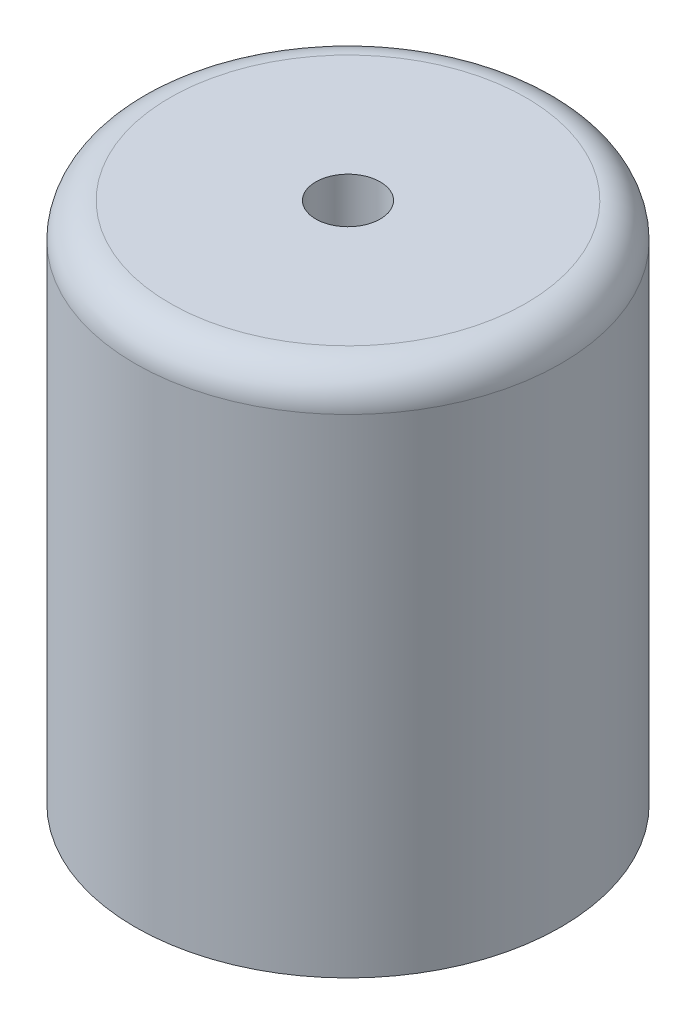
from build123d import *

# Parameters (mm, degrees)
BOSS_EXTRUDE1_DEPTH      = 8.509
BOSS_EXTRUDE1_DEPTH_BACK = 8.509
SKETCH3_R                = 15.519490552
BOSS_EXTRUDE2_DEPTH      = 38.1
SKETCH4_R                = 10.825000036
CUT_EXTRUDE1_DEPTH       = 31.75
CUT_EXTRUDE2_DEPTH       = 73.611468784
CUT_EXTRUDE2_DEPTH_BACK  = 73.611468784
SKETCH5_W                = 9.906
SKETCH5_H                = 56.435801088
SKETCH6_R                = 5.08
CUT_EXTRUDE3_DEPTH       = 75.892851262
CHAMFER1_SIZE            = 0.254
CHAMFER2_SIZE            = 0.508
FILLET1_R                = 1.27
FILLET2_R                = 1.27
SKETCH11_R               = 15.519490552
CUT_EXTRUDE4_DEPTH       = 45.520887291
FILLET4_R                = 2.54
SKETCH12_R               = 2.3495
CUT_EXTRUDE5_DEPTH       = 44.969525515
CUT_EXTRUDE6_START       = 31.75
SKETCH13_R               = 10.875012636
CUT_EXTRUDE6_DEPTH       = 23.876
CUT_EXTRUDE7_START       = 23.876
SKETCH14_R               = 10.925012636
CUT_EXTRUDE7_DEPTH       = 16.002


with BuildPart() as part:
    # Sketch2 → Boss-Extrude1 (new, two sides: drawn at the far end of the back side and taken through both)
    with BuildSketch(Plane.XY.offset(-BOSS_EXTRUDE1_DEPTH_BACK)):
        with BuildLine():
            Line((11.43, -31.115), (7.565118148, 0.912900544))
            ThreePointArc((7.565118148, 0.912900544), (0, 7.62), (-7.565118148, 0.912900544))
            Line((-7.565118148, 0.912900544), (-11.43, -31.115))
            Line((-11.43, -31.115), (11.43, -31.115))
        make_face()
    extrude(amount=BOSS_EXTRUDE1_DEPTH + BOSS_EXTRUDE1_DEPTH_BACK)

    # Sketch3 → Boss-Extrude2 (add)
    with BuildSketch(Plane.XZ.offset(31.115)):
        with Locations(Location((0, 0, 0), (0, 0, 180))):
            Circle(SKETCH3_R)
    extrude(amount=BOSS_EXTRUDE2_DEPTH)

    # Sketch4 → Cut-Extrude1 (cut)
    with BuildSketch(Plane.XZ.offset(69.215)):
        Circle(SKETCH4_R)
    extrude(amount=-CUT_EXTRUDE1_DEPTH, mode=Mode.SUBTRACT)

    # Sketch5 → Cut-Extrude2 (cut, two sides: drawn at the far end of the back side and taken through both)
    with BuildSketch(Plane(origin=(0, 0, 0), x_dir=(0, 0, -1), z_dir=(1, 0, 0)).offset(-CUT_EXTRUDE2_DEPTH_BACK)):
        with Locations((0, 0.912900544)):
            Rectangle(SKETCH5_W, SKETCH5_H)
    extrude(amount=CUT_EXTRUDE2_DEPTH + CUT_EXTRUDE2_DEPTH_BACK, mode=Mode.SUBTRACT)

    # Sketch6 → Cut-Extrude3 (cut, through all)
    with BuildSketch(Plane(origin=(0, 0, -8.509), x_dir=(-1, 0, 0), z_dir=(0, 0, -1))):
        with Locations(Location((0, 0, 0), (0, 0, 180))):
            Circle(SKETCH6_R)
    extrude(amount=-CUT_EXTRUDE3_DEPTH, mode=Mode.SUBTRACT)

    # Chamfer1
    chamfer1_edges = [part.edges().sort_by_distance(p)[0] for p in [
        (-5.08, 0, 8.509),
        (-5.08, 0, -4.953),
        (-5.08, 0, 4.953),
        (-5.08, 0, -8.509),
    ]]
    chamfer(chamfer1_edges, length=CHAMFER1_SIZE)

    # Chamfer2
    chamfer2_edges = [part.edges().sort_by_distance(p)[0] for p in [
        (-10.825000036, -69.215, 0),
    ]]
    chamfer(chamfer2_edges, length=CHAMFER2_SIZE)

    # Fillet1
    fillet1_edges = [part.edges().sort_by_distance(p)[0] for p in [
        (-9.497559074, -15.101049728, -8.509),
        (9.497559074, -15.101049728, -8.509),
        (0, 7.62, -8.509),
        (-9.497559074, -15.101049728, 8.509),
        (9.497559074, -15.101049728, 8.509),
        (0, 7.62, 8.509),
    ]]
    fillet(fillet1_edges, radius=FILLET1_R)

    # Fillet2
    fillet2_edges = [part.edges().sort_by_distance(p)[0] for p in [
        (11.43, -31.115, 0),
        (-11.43, -31.115, 0),
        (11.053691049, -31.115, -8.138646936),
        (11.053691049, -31.115, 8.138646936),
        (-11.053691049, -31.115, -8.138646936),
        (-11.053691049, -31.115, 8.138646936),
        (0, -31.115, -8.509),
        (0, -31.115, 8.509),
    ]]
    fillet(fillet2_edges, radius=FILLET2_R)

    # Sketch11 → Cut-Extrude4 (cut, through all)
    with BuildSketch(Plane(origin=(0, -31.115, 0), x_dir=(1, 0, 0), z_dir=(0, 1, 0))):
        with Locations(Location((0, 0, 0), (0, 0, 180))):
            Circle(SKETCH11_R)
    extrude(amount=CUT_EXTRUDE4_DEPTH, mode=Mode.SUBTRACT)

    # Fillet4
    fillet4_edges = [part.edges().sort_by_distance(p)[0] for p in [
        (15.519490552, -31.115, 0),
    ]]
    fillet(fillet4_edges, radius=FILLET4_R)

    # Sketch12 → Cut-Extrude5 (cut, through all)
    with BuildSketch(Plane(origin=(0, -31.115, 0), x_dir=(1, 0, 0), z_dir=(0, 1, 0))):
        with Locations(Location((0, 0, 0), (0, 0, 180))):
            Circle(SKETCH12_R)
    extrude(amount=-CUT_EXTRUDE5_DEPTH, mode=Mode.SUBTRACT)

    # Sketch13 → Cut-Extrude6 (cut)
    with BuildSketch(Plane.XZ.offset(37.465).offset(CUT_EXTRUDE6_START)):
        Circle(SKETCH13_R)
    extrude(amount=-CUT_EXTRUDE6_DEPTH, mode=Mode.SUBTRACT)

    # Sketch14 → Cut-Extrude7 (cut)
    with BuildSketch(Plane.XZ.offset(45.339).offset(CUT_EXTRUDE7_START)):
        Circle(SKETCH14_R)
    extrude(amount=-CUT_EXTRUDE7_DEPTH, mode=Mode.SUBTRACT)


solid = part.part
